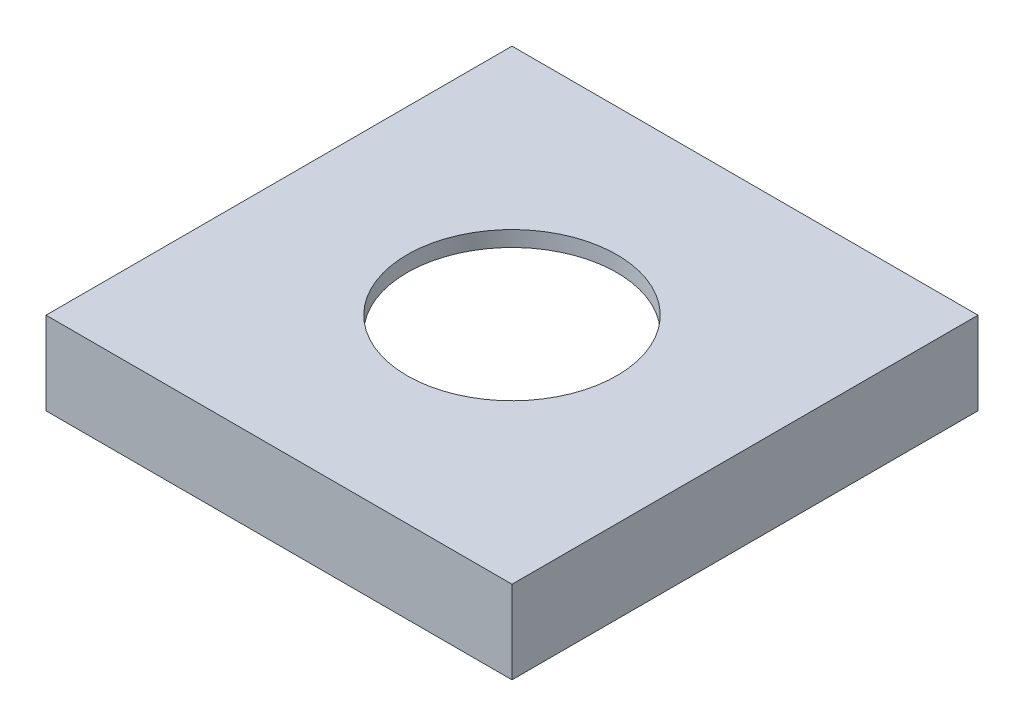
from build123d import *

# Parameters (mm, degrees)
SKETCH1_W           = 36
SKETCH1_H           = 36
SKETCH1_W_2         = 31.2
SKETCH1_H_2         = 31.2
BOSS_EXTRUDE1_DEPTH = 5.2
SKETCH2_W           = 36
SKETCH2_H           = 36
SKETCH2_W_2         = 21.6
SKETCH2_H_2         = 21.6
BOSS_EXTRUDE2_DEPTH = 1.2
SKETCH3_W           = 21.6
SKETCH3_H           = 21.6
SKETCH3_R           = 8.1
BOSS_EXTRUDE3_DEPTH = 1.2


with BuildPart() as part:
    # Sketch1 → Boss-Extrude1 (new body)
    with BuildSketch(Plane(origin=(0, 0, 0), x_dir=(1, 0, 0), z_dir=(0, 1, 0))):
        Rectangle(SKETCH1_W, SKETCH1_H)
        Rectangle(SKETCH1_W_2, SKETCH1_H_2, mode=Mode.SUBTRACT)
    extrude(amount=BOSS_EXTRUDE1_DEPTH)

    # Sketch2 → Boss-Extrude2 (add)
    with BuildSketch(Plane(origin=(0, 5.2, 0), x_dir=(1, 0, 0), z_dir=(0, 1, 0))):
        Rectangle(SKETCH2_W, SKETCH2_H)
        Rectangle(SKETCH2_W_2, SKETCH2_H_2, mode=Mode.SUBTRACT)
    extrude(amount=BOSS_EXTRUDE2_DEPTH)

    # Sketch3 → Boss-Extrude3 (add)
    with BuildSketch(Plane(origin=(0, 6.4, 0), x_dir=(1, 0, 0), z_dir=(0, 1, 0))):
        Rectangle(SKETCH3_W, SKETCH3_H)
        with Locations(Location((0, 0, 0), (0, 0, 270))):
            Circle(SKETCH3_R, mode=Mode.SUBTRACT)
    extrude(amount=-BOSS_EXTRUDE3_DEPTH)


solid = part.part
